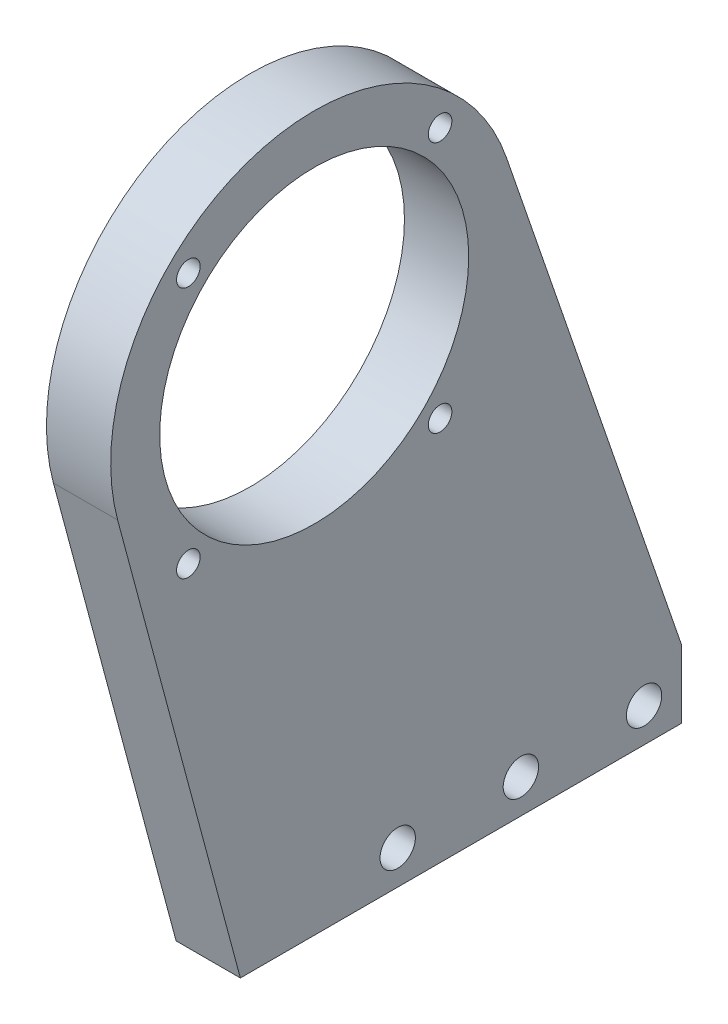
from build123d import *

# Parameters (mm, degrees)
SKETCH1_R           = 38
SKETCH1_R_2         = 2.2
SKETCH1_R_3         = 28.85
SKETCH1_R_4         = 3.3
BOSS_EXTRUDE1_DEPTH = 12.7
MOVE_FACE4_BY       = 0.7


with BuildPart() as part:
    # Sketch1 → Boss-Extrude1 (new body)
    # profile 1 of 2: a face of its own
    with BuildSketch(Plane(origin=(0, 0, 0), x_dir=(0, 0, -1), z_dir=(1, 0, 0))):
        Circle(SKETCH1_R)
        with Locations((23.5, -23.5)):
            Circle(SKETCH1_R_2, mode=Mode.SUBTRACT)
        with Locations((-23.5, -23.5)):
            Circle(SKETCH1_R_2, mode=Mode.SUBTRACT)
        with Locations((23.5, 23.5)):
            Circle(SKETCH1_R_2, mode=Mode.SUBTRACT)
        with Locations((-23.5, 23.5)):
            Circle(SKETCH1_R_2, mode=Mode.SUBTRACT)
        Circle(SKETCH1_R_3, mode=Mode.SUBTRACT)
    # profile 2 of 2: a face of its own
    with BuildSketch(Plane(origin=(0, 0, 0), x_dir=(0, 0, -1), z_dir=(1, 0, 0))):
        with BuildLine():
            ThreePointArc((38, 0), (4.959995304, -37.674904732), (-36.705181399, -9.835123714))
            Line((-36.705181399, -9.835123714), (-13.791539357, -95.35))
            Line((-13.791539357, -95.35), (68.588460643, -95.35))
            Line((68.588460643, -95.35), (68.588460643, -82.65))
            Line((68.588460643, -82.65), (35.936663125, 12.351366055))
            ThreePointArc((35.936663125, 12.351366055), (37.480616315, 6.261261903), (38, 0))
        make_face()
        with Locations((15.59, -89)):
            Circle(SKETCH1_R_4, mode=Mode.SUBTRACT)
        with Locations((38.59, -89)):
            Circle(SKETCH1_R_4, mode=Mode.SUBTRACT)
        with Locations((61.59, -89)):
            Circle(SKETCH1_R_4, mode=Mode.SUBTRACT)
    extrude(amount=BOSS_EXTRUDE1_DEPTH)

    # Move Face4: a face moved inward by 0.7
    extrude(part.faces().sort_by_distance((12.7, -45.322375042, -15.580878329))[0], amount=MOVE_FACE4_BY, dir=(-1, 0, 0), mode=Mode.SUBTRACT)


solid = part.part
